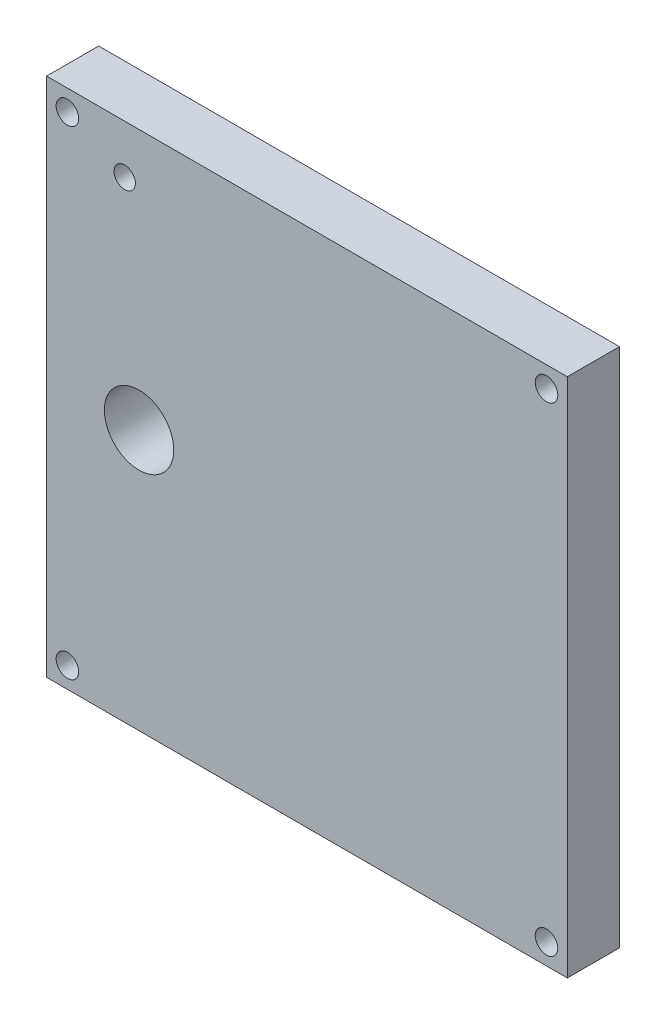
from build123d import *

# Parameters (mm, degrees)
SKETCH1_W               = 150
SKETCH1_H               = 150
BOSS_EXTRUDE1_DEPTH     = 7.5
SKETCH2_R               = 3.075
CUT_EXTRUDE2_DEPTH      = 32
SKETCH5_R               = 10
CUT_EXTRUDE5_DEPTH      = 22
SKETCH6_R               = 3.25
CUT_EXTRUDE6_DEPTH      = 22
MIRROR2_COPY_1_SKETCH_R = 3.25
MIRROR2_COPY_1_DEPTH    = 22


with BuildPart() as part:
    # Sketch1 → Boss-Extrude1 (new, symmetric)
    with BuildSketch(Plane.XY):
        Rectangle(SKETCH1_W, SKETCH1_H)
    extrude(amount=BOSS_EXTRUDE1_DEPTH, both=True)

    # Sketch2 → Cut-Extrude2 (cut)
    with BuildSketch(Plane(origin=(0, 0, -7.5), x_dir=(-1, 0, 0), z_dir=(0, 0, -1))):
        with Locations((52.5, 61)):
            Circle(SKETCH2_R)
    extrude(amount=-CUT_EXTRUDE2_DEPTH, mode=Mode.SUBTRACT)

    # Sketch5 → Cut-Extrude5 (cut)
    with BuildSketch(Plane.XY.offset(7.5)):
        with Locations((-48.369109736, 0)):
            Circle(SKETCH5_R)
    extrude(amount=-CUT_EXTRUDE5_DEPTH, mode=Mode.SUBTRACT)

    # Sketch6 → Cut-Extrude6 (cut)
    with BuildSketch(Plane(origin=(0, 0, -7.5), x_dir=(-1, 0, 0), z_dir=(0, 0, -1))):
        with Locations((69, 69)):
            Circle(SKETCH6_R)
    cut_extrude6 = extrude(amount=-CUT_EXTRUDE6_DEPTH, mode=Mode.SUBTRACT)

    # Mirror1: Cut-Extrude6 across plane
    add(cut_extrude6.mirror(Plane.ZX), mode=Mode.SUBTRACT)

    # Mirror2: Cut-Extrude6 across plane
    add(cut_extrude6.mirror(Plane(origin=(0, 0, 0), x_dir=(0, 0, 1), z_dir=(1, 0, 0))), mode=Mode.SUBTRACT)

    # Mirror2 copy 1 sketch → Mirror2 copy 1 (cut)
    with BuildSketch(Plane(origin=(0, 0, -7.5), x_dir=(1, 0, 0), z_dir=(0, 0, -1))):
        with Locations((69, 69)):
            Circle(MIRROR2_COPY_1_SKETCH_R)
    extrude(amount=-MIRROR2_COPY_1_DEPTH, mode=Mode.SUBTRACT)


solid = part.part
